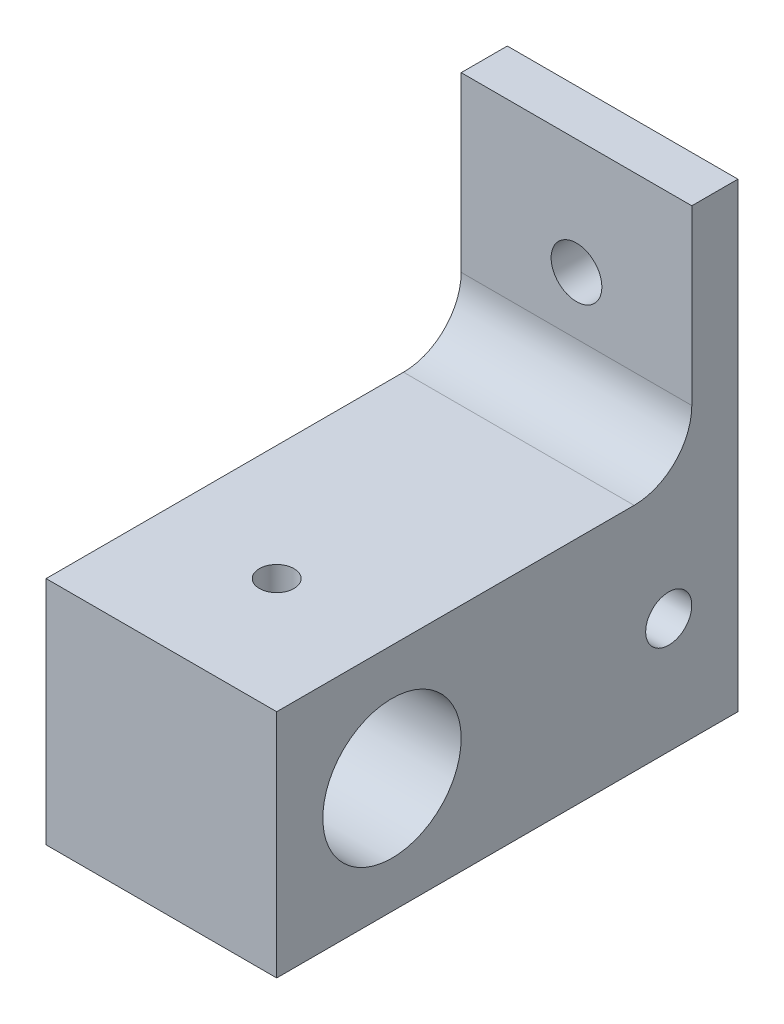
from build123d import *

# Parameters (mm, degrees)
SKETCH1_W                  = 20
SKETCH1_H                  = 20
BOSS_EXTRUDE1_DEPTH        = 40
SKETCH2_R                  = 6
CUT_EXTRUDE1_DEPTH         = 30
F_3_0MM_DOWEL_HOLE1_REACH  = 50.99
F_3_0MM_DOWEL_HOLE1_BORE_R = 1.5
SKETCH5_R                  = 2
CUT_EXTRUDE2_DEPTH         = 30
SKETCH6_W                  = 20
SKETCH6_H                  = 4
BOSS_EXTRUDE2_DEPTH        = 20
F_4_4_4_4_DIAMETER_HOLE1_D = 4.4
FILLET1_R                  = 5


with BuildPart() as part:
    # Sketch1 → Boss-Extrude1 (new body)
    with BuildSketch(Plane.XY):
        with Locations((10, 10)):
            Rectangle(SKETCH1_W, SKETCH1_H)
    extrude(amount=BOSS_EXTRUDE1_DEPTH)

    # Sketch2 → Cut-Extrude1 (cut)
    with BuildSketch(Plane(origin=(20, 0, 0), x_dir=(0, 0, -1), z_dir=(1, 0, 0))):
        with Locations((-30, 10)):
            Circle(SKETCH2_R)
    extrude(amount=-CUT_EXTRUDE1_DEPTH, mode=Mode.SUBTRACT)

    # Ø3.0mm Dowel Hole1 bore → Ø3.0mm Dowel Hole1 (cut, up to next)
    with BuildSketch(Plane(origin=(0, 20, 0), x_dir=(1, 0, 0), z_dir=(0, 1, 0)), mode=Mode.PRIVATE) as f_3_0mm_dowel_hole1_sk1:
        with Locations((10, -30)):
            Circle(F_3_0MM_DOWEL_HOLE1_BORE_R)
    f_3_0mm_dowel_hole1_tool1 = extrude(f_3_0mm_dowel_hole1_sk1.sketch, amount=-F_3_0MM_DOWEL_HOLE1_REACH, mode=Mode.PRIVATE) & part.part
    add(f_3_0mm_dowel_hole1_tool1.solids().sort_by_distance((10, 20, 30))[0], mode=Mode.SUBTRACT)

    # Sketch5 → Cut-Extrude2 (cut)
    with BuildSketch(Plane.ZY):
        with Locations((6, 10)):
            Circle(SKETCH5_R)
    extrude(amount=-CUT_EXTRUDE2_DEPTH, mode=Mode.SUBTRACT)

    # Sketch6 → Boss-Extrude2 (add)
    with BuildSketch(Plane(origin=(0, 20, 0), x_dir=(1, 0, 0), z_dir=(0, 1, 0))):
        with Locations((10, -2)):
            Rectangle(SKETCH6_W, SKETCH6_H)
    extrude(amount=BOSS_EXTRUDE2_DEPTH)

    # Ø4.4 (4.4) Diameter Hole1 (through all)
    with Locations(Plane.XY.offset(4)):
        with Locations((10, 30)):
            Hole(F_4_4_4_4_DIAMETER_HOLE1_D / 2)

    # Fillet1
    fillet1_edges = [part.edges().sort_by_distance(p)[0] for p in [
        (10, 20, 4),
    ]]
    fillet(fillet1_edges, radius=FILLET1_R)


solid = part.part
